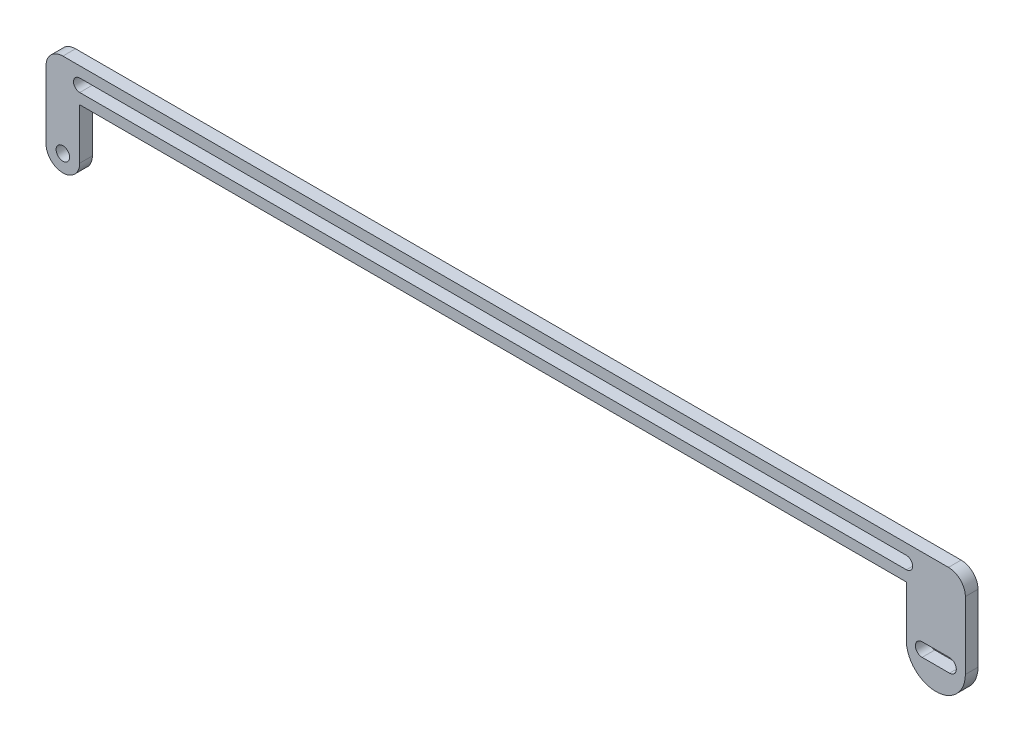
from build123d import *

# Parameters (mm, degrees)
SKETCH_1_R      = 1.6
EXTRUDE_1_DEPTH = 3


with BuildPart() as part:
    # 草图1 → 凸台-拉伸1 (new body)
    with BuildSketch(Plane.XY):
        with BuildLine():
            Line((-53.850242828, 4), (156.149757172, 4))
            ThreePointArc((156.149757172, 4), (158.978184297, 2.828427125), (160.149757172, 0))
            Line((160.149757172, 0), (160.149757172, -16))
            ThreePointArc((160.149757172, -16), (152.900492864, -22.992597394), (146.173644012, -15.496081147))
            Line((146.173644012, -15.496081147), (146.173644012, -4))
            Line((146.173644012, -4), (-49.850242828, -4))
            Line((-49.850242828, -4), (-49.850242828, -16))
            ThreePointArc((-49.850242828, -16), (-53.850242828, -20), (-57.850242828, -16))
            Line((-57.850242828, -16), (-57.850242828, 0))
            ThreePointArc((-57.850242828, 0), (-56.678669953, 2.828427125), (-53.850242828, 4))
        make_face()
        with Locations((-53.850242828, -16)):
            Circle(SKETCH_1_R, mode=Mode.SUBTRACT)
        with BuildLine():
            Line((-49.850242828, 1.483471582), (146.173644012, 1.483471582))
            ThreePointArc((146.173644012, 1.483471582), (147.657115594, 0), (146.173644012, -1.483471582))
            Line((146.173644012, -1.483471582), (-49.850242828, -1.483471582))
            ThreePointArc((-49.850242828, -1.483471582), (-51.33371441, 0), (-49.850242828, 1.483471582))
        make_face(mode=Mode.SUBTRACT)
        with BuildLine():
            Line((149.900261056, -14.4), (156.40497097, -14.4))
            ThreePointArc((156.40497097, -14.4), (158.00497097, -16), (156.40497097, -17.6))
            Line((156.40497097, -17.6), (149.900261056, -17.6))
            ThreePointArc((149.900261056, -17.6), (148.300261056, -16), (149.900261056, -14.4))
        make_face(mode=Mode.SUBTRACT)
    extrude(amount=EXTRUDE_1_DEPTH)


solid = part.part
